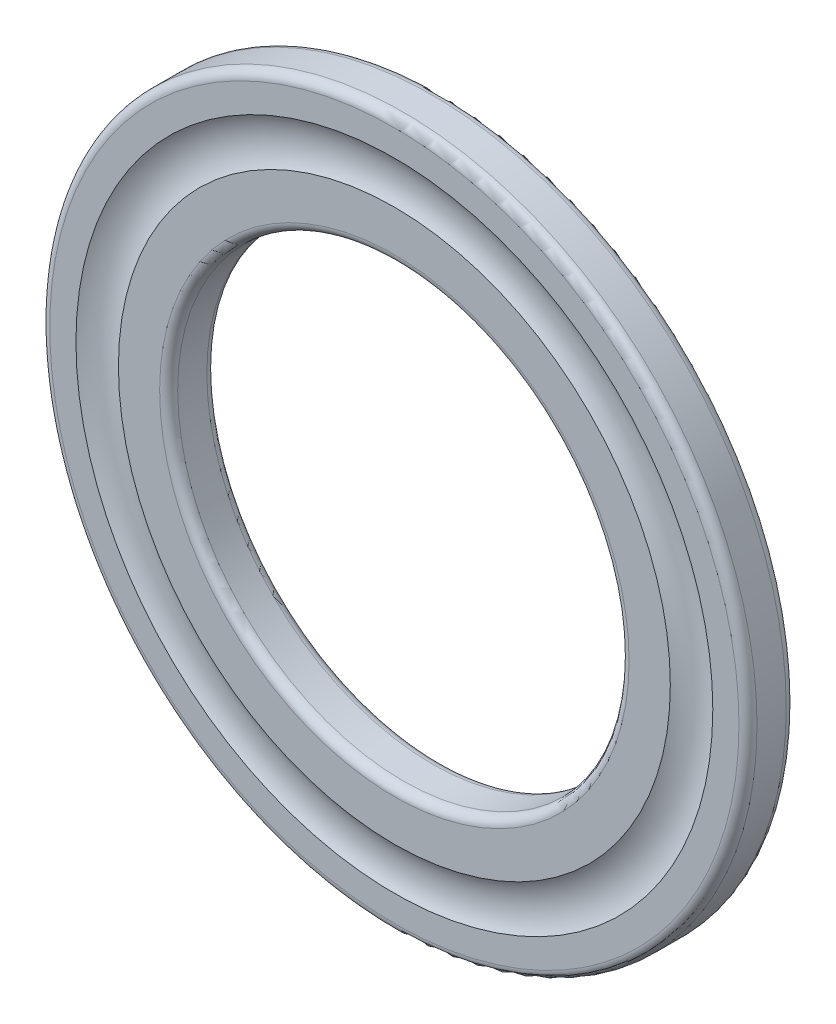
from build123d import *

# Parameters (mm, degrees)
ESQUISSE1_R        = 23.5
ESQUISSE1_R_2      = 15
BOSS_EXTRU_1_DEPTH = 3.14
ESQUISSE2_R        = 2.75
CONG_1_R           = 0.6


with BuildPart() as part:
    # Esquisse1 → Boss.-Extru.1 (new body)
    with BuildSketch(Plane.XY):
        Circle(ESQUISSE1_R)
        Circle(ESQUISSE1_R_2, mode=Mode.SUBTRACT)
    extrude(amount=BOSS_EXTRU_1_DEPTH)

    # Esquisse2 → Enlèvement de matière-Révolution1 (revolve, cut)
    with BuildSketch(Plane(origin=(0, 0, 0), x_dir=(1, 0, 0), z_dir=(0, 1, 0)), mode=Mode.PRIVATE) as enl_vement_de_mati_re_r_volution1_sk:
        with Locations((19.75, -5.5)):
            Circle(ESQUISSE2_R)
    revolve(enl_vement_de_mati_re_r_volution1_sk.sketch.rotate(Axis((0, 0, 0), (0, 0, 1)), 180), axis=Axis((0, 0, 0), (0, 0, 1)), mode=Mode.SUBTRACT)

    # Congé1
    cong_1_edges = [part.edges().sort_by_distance(p)[0] for p in [
        (-23.5, 0, 0),
        (-23.5, 0, 3.14),
        (-15, 0, 0),
        (-15, 0, 3.14),
    ]]
    fillet(cong_1_edges, radius=CONG_1_R)


solid = part.part
